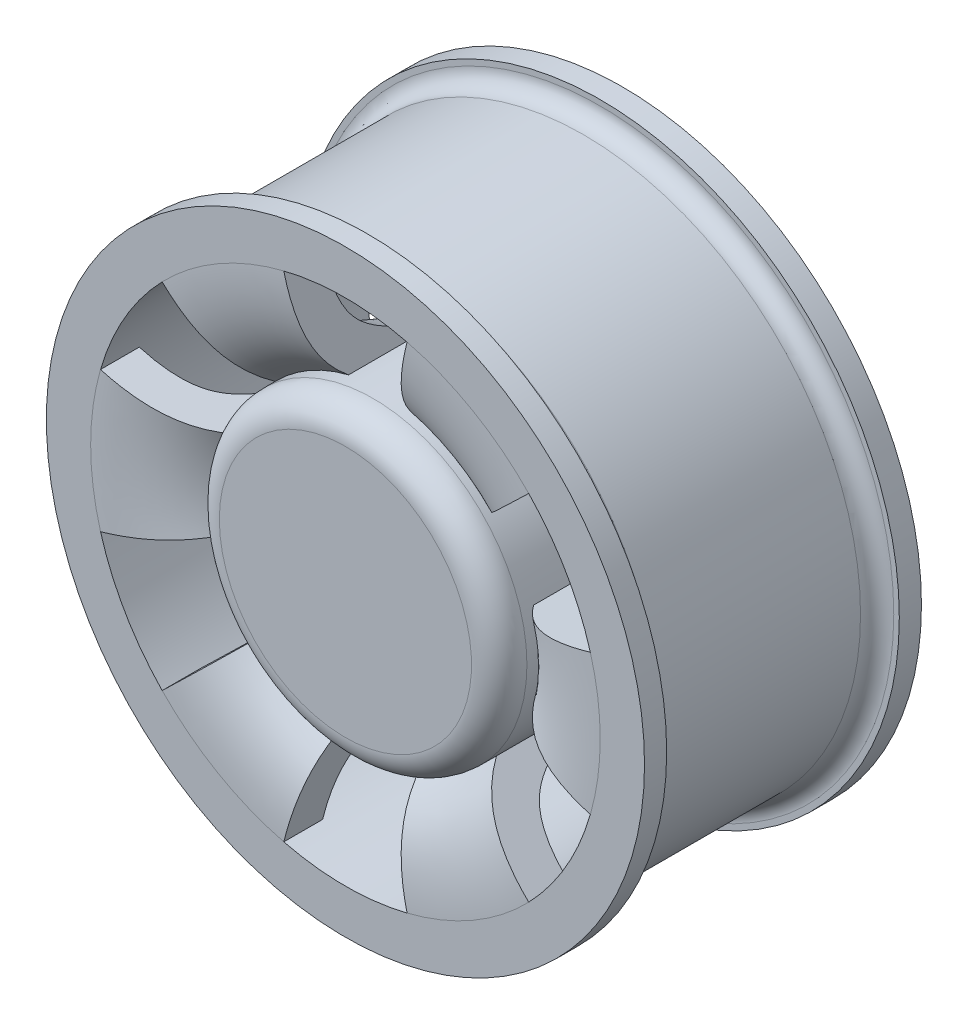
from build123d import *
from build123d.topology import SkipClean

# Parameters (mm, degrees)
SKETCH_2_R               = 27.769549516
SKETCH_2_R_2             = 20.5
EXTRUDE_1_DEPTH          = 25
EXTRUDE_START            = -5
SKETCH_3_R               = 27.769549516
EXTRUDE_2_DEPTH          = 5
CUT_EXTRUDE_1_DEPTH      = 92.279789658
PATTERN_CIRCULAR_1_COUNT = 6
FILLET_1_R               = 5
PATTERN_CIRCULAR_3_COUNT = 6
CHAMFER_2_SIZE           = 0.6


with BuildPart() as part:
    # Эскиз1 → Повернуть1 (revolve)
    with BuildSketch(Plane(origin=(0, 0, 0), x_dir=(1, 0, 0), z_dir=(0, 1, 0))):
        with BuildLine():
            Line((46, 25), (46, -18))
            add(Edge.make_bspline(
                [(46, -18), (45.534248642, -18), (44.5772348, -17.982516027), (42.869174233, -17.882520452), (40.971223241, -17.645341355), (39.089698837, -17.216879559), (37.032168255, -16.497648539), (35.152741052, -15.398153148), (33.363818276, -13.658039827), (31.699827523, -11.130162449), (30.407488479, -8.238510365), (29.424322364, -5.487388249), (28.702657392, -3.222565982), (28.15298113, -1.348976686), (27.84029187, -0.249975343), (27.769554045, 0)],
                knots=[0, 0, 0, 0, 0.03125, 0.0625, 0.125, 0.1875, 0.25, 0.375, 0.5, 0.625, 0.75, 0.8125, 0.875, 0.9375, 0.955635325, 0.955635325, 0.955635325, 0.955635325], degree=3))
            Line((27.769554045, 0), (20.5, 0))
            add(Edge.make_bspline(
                [(46, -25), (27.827750571, -25), (24.533345692, -14.496137093), (20.5, 0)],
                knots=[0, 0, 0, 0, 1, 1, 1, 1], degree=3))
            Line((46, -25), (54, -25))
            Line((54, -25), (54, -21))
            Line((54, -21), (53, -21))
            ThreePointArc((53, -21), (50.878679656, -20.121320344), (50, -18))
            Line((50, -18), (50, 18))
            ThreePointArc((50, 18), (50.878679656, 20.121320344), (53, 21))
            Line((53, 21), (54, 21))
            Line((54, 21), (54, 25))
            Line((54, 25), (46, 25))
        make_face()
    revolve(axis=Axis((0, 0, 0), (0, 0, -1)))

    # Эскиз2 → Бобышка-Вытянуть1 (add, through all)
    with BuildSketch(Plane(origin=(0, 0, 0), x_dir=(-1, 0, 0), z_dir=(0, 0, -1))):
        Circle(SKETCH_2_R)
        Circle(SKETCH_2_R_2, mode=Mode.SUBTRACT)
    extrude(amount=-EXTRUDE_1_DEPTH)

    # Эскиз3 → Бобышка-Вытянуть2 (add)
    with BuildSketch(Plane.XY.offset(25).offset(EXTRUDE_START)):
        with Locations(Location((0, 0, 0), (0, 0, 180))):
            Circle(SKETCH_3_R)
    extrude(amount=EXTRUDE_2_DEPTH)

    # Эскиз4 → Вырез-Вытянуть1 (cut, through all)
    with SkipClean():  # the faces are left unmerged after this step: merging them gives an invalid solid
        with BuildSketch(Plane.XY.offset(25)):
            with BuildLine():
                Line((-6.718062059, 26.944675216), (-11.128407198, 44.633603409))
                ThreePointArc((-11.128407198, 44.633603409), (0, 46), (11.128407198, 44.633603409))
                Line((11.128407198, 44.633603409), (6.718062059, 26.944675216))
                ThreePointArc((6.718062059, 26.944675216), (0, 27.769549516), (-6.718062059, 26.944675216))
            make_face()
        cut_extrude_1 = extrude(amount=-CUT_EXTRUDE_1_DEPTH, mode=Mode.SUBTRACT)

    # Круговой массив1: Вырез-Вытянуть1 ×6 about axis
    pattern_circular_1_axis = Axis((0, 0, 0), (0, 0, 1))
    for i in range(1, PATTERN_CIRCULAR_1_COUNT):
        add(cut_extrude_1.rotate(pattern_circular_1_axis, i * 360 / PATTERN_CIRCULAR_1_COUNT), mode=Mode.SUBTRACT)

    # Скругление1
    fillet_1_edges = [part.edges().sort_by_distance(p)[0] for p in [
        (-10.402656345, 25.747477959, 25),
    ]]
    fillet(fillet_1_edges, radius=FILLET_1_R)

    # Эскиз13 → Сверление под метчик M51 (revolve, cut)
    with BuildSketch(Plane.YZ.offset(-23.75)):
        Polygon((0, 0), (0, 23.2618073), (2.1, 22), (2.1, 0), align=None)
    hole_wizard_m51 = revolve(axis=Axis((-23.75, 0, -6.35), (0, 0, 1)), mode=Mode.SUBTRACT)

    # Круговой массив3: Сверление под метчик M51 ×6 about axis
    pattern_circular_3_axis = Axis((0, 0, 0), (0, 0, 1))
    for i in range(1, PATTERN_CIRCULAR_3_COUNT):
        add(hole_wizard_m51.rotate(pattern_circular_3_axis, i * 360 / PATTERN_CIRCULAR_3_COUNT), mode=Mode.SUBTRACT)

    # Фаска2
    chamfer_2_edges = [part.edges().sort_by_distance(p)[0] for p in [
        (-23.75, -2.1, 0),
        (-10.056346652, -21.61810334, 0),
        (13.693653348, -19.51810334, 0),
        (23.75, 2.1, 0),
        (10.056346652, 21.61810334, 0),
        (-13.693653348, 19.51810334, 0),
    ]]
    chamfer(chamfer_2_edges, length=CHAMFER_2_SIZE)


solid = part.part
